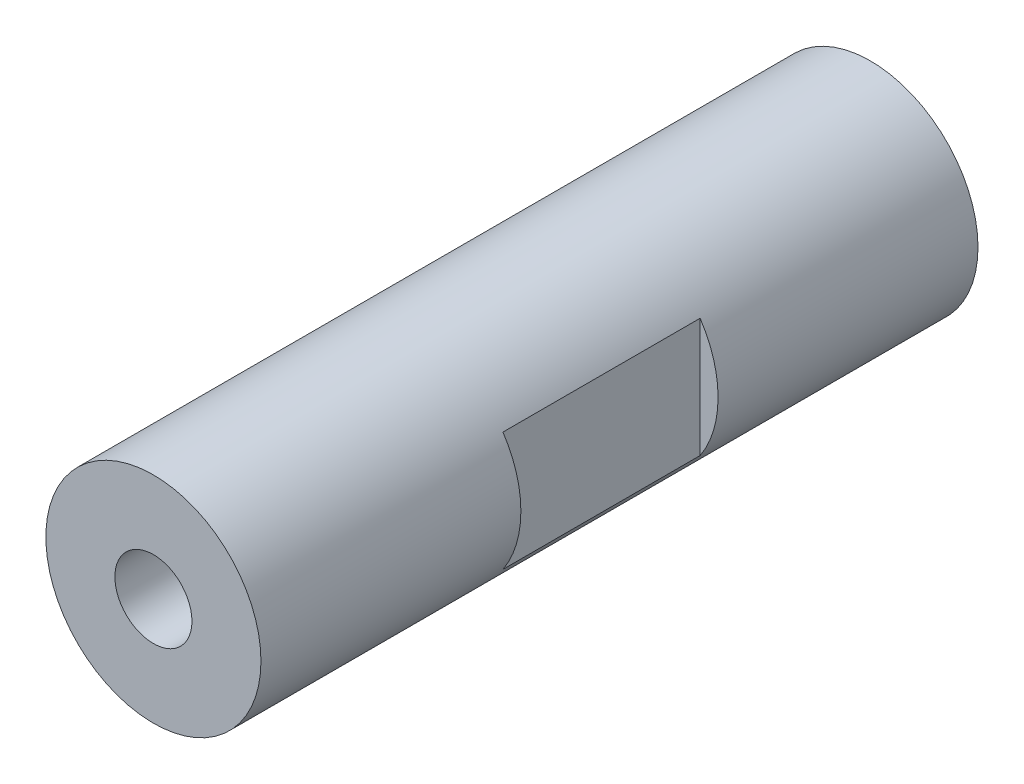
from build123d import *

# Parameters (mm, degrees)
SKETCH_1_R               = 6
SKETCH_1_R_2             = 2.15
EXTRUDE_1_DEPTH          = 40
CUT_EXTRUDE_1_DEPTH      = 41.890096601
CUT_EXTRUDE_1_DEPTH_BACK = 41.890096601
SKETCH_2_W               = 1
SKETCH_2_H               = 11


with BuildPart() as part:
    # Эскиз1 → Бобышка-Вытянуть1 (new body)
    with BuildSketch(Plane.XY):
        Circle(SKETCH_1_R)
        Circle(SKETCH_1_R_2, mode=Mode.SUBTRACT)
    extrude(amount=EXTRUDE_1_DEPTH)

    # Эскиз2 → Вырез-Вытянуть1 (cut, two sides: drawn at the far end of the back side and taken through both)
    with BuildSketch(Plane(origin=(0, 0, 0), x_dir=(1, 0, 0), z_dir=(0, 1, 0)).offset(-CUT_EXTRUDE_1_DEPTH_BACK)):
        with Locations((-5.5, -20)):
            Rectangle(SKETCH_2_W, SKETCH_2_H)
        with Locations((5.5, -20)):
            Rectangle(SKETCH_2_W, SKETCH_2_H)
    extrude(amount=CUT_EXTRUDE_1_DEPTH + CUT_EXTRUDE_1_DEPTH_BACK, mode=Mode.SUBTRACT)


solid = part.part
